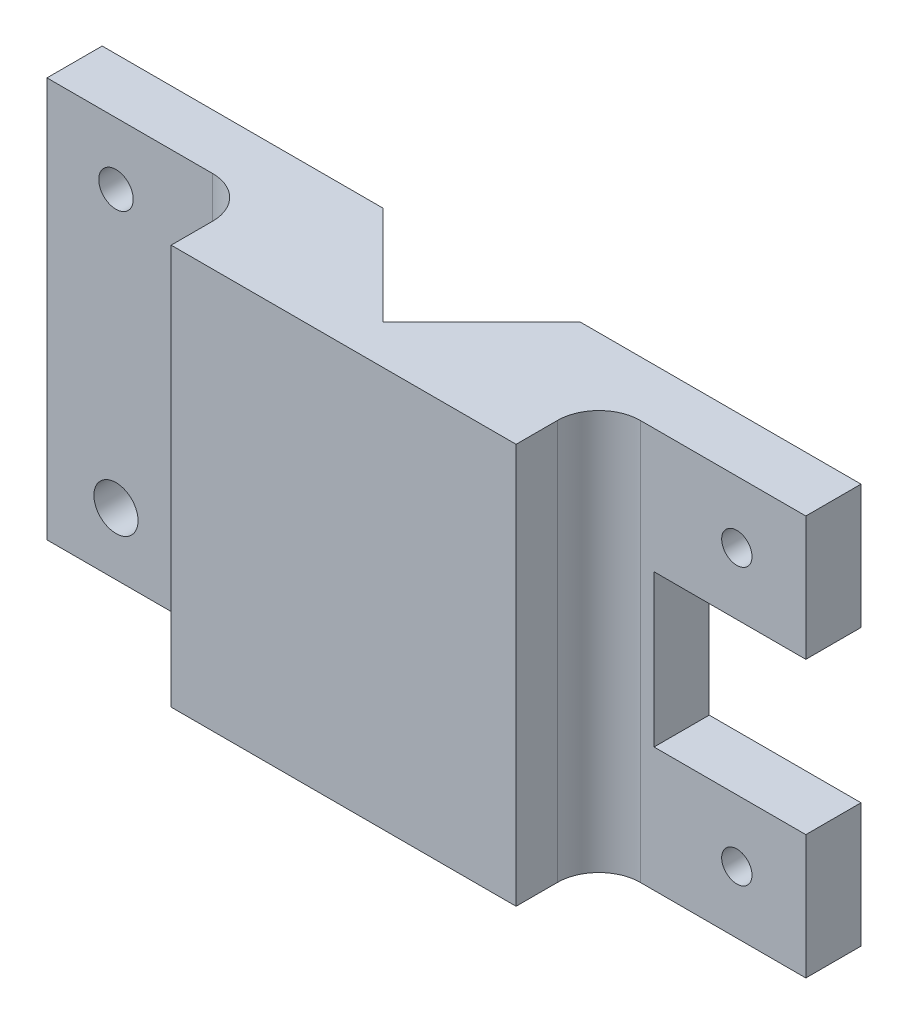
from build123d import *

# Parameters (mm, degrees)
BOSS_EXTRUDE1_DEPTH     = 14.5
CUT_EXTRUDE2_DEPTH      = 32.662280398
CUT_EXTRUDE2_DEPTH_BACK = 32.662280398
SKETCH4_R               = 1.1
SKETCH4_W               = 11
SKETCH4_H               = 11
SKETCH5_R               = 1.25
SKETCH5_R_2             = 1.6
CUT_EXTRUDE3_DEPTH      = 32.662280398
FILLET1_R               = 3


with BuildPart() as part:
    # Sketch1 → Boss-Extrude1 (new, symmetric)
    with BuildSketch(Plane(origin=(0, 0, 0), x_dir=(1, 0, 0), z_dir=(0, 1, 0))):
        Polygon((-7.131727984, 0), (-27.5, 0), (-27.5, -4), (-12.5, -4), (-12.5, -10), (12.5, -10), (12.5, -4), (27.5, -4), (27.5, 0), (7.131727984, 0), (0, -7.131727984), align=None)
    extrude(amount=BOSS_EXTRUDE1_DEPTH, both=True)

    # Sketch4 → Cut-Extrude2 (cut, two sides: drawn at the far end of the back side and taken through both)
    with BuildSketch(Plane.XY.offset(4).offset(-CUT_EXTRUDE2_DEPTH_BACK)):
        with Locations((22.5, 10)):
            Circle(SKETCH4_R)
        with Locations((22.5, -10)):
            Circle(SKETCH4_R)
        with Locations((22, 0)):
            Rectangle(SKETCH4_W, SKETCH4_H)
    extrude(amount=CUT_EXTRUDE2_DEPTH + CUT_EXTRUDE2_DEPTH_BACK, mode=Mode.SUBTRACT)

    # Sketch5 → Cut-Extrude3 (cut, through all)
    with BuildSketch(Plane.XY.offset(4)):
        with Locations((-22.5, 10)):
            Circle(SKETCH5_R)
        with Locations((-22.5, -10)):
            Circle(SKETCH5_R_2)
    extrude(amount=-CUT_EXTRUDE3_DEPTH, mode=Mode.SUBTRACT)

    # Fillet1
    fillet1_edges = [part.edges().sort_by_distance(p)[0] for p in [
        (-12.5, 0, 4),
        (12.5, 0, 4),
    ]]
    fillet(fillet1_edges, radius=FILLET1_R)


solid = part.part
